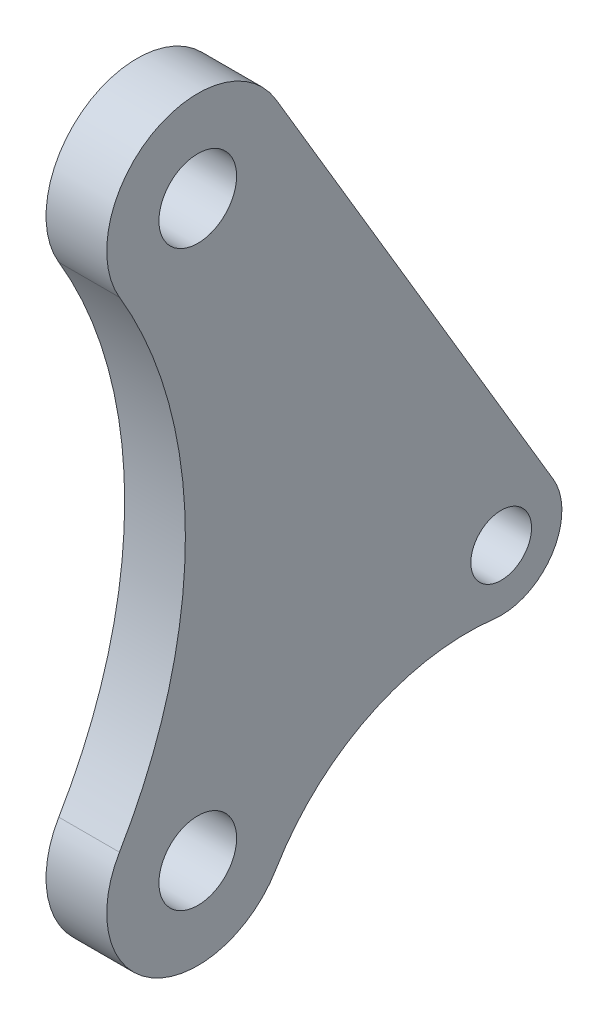
from build123d import *

# Parameters (mm, degrees)
BOSS_EXTRUDE1_DEPTH = 3.175
SKETCH2_R           = 2.032
SKETCH2_R_2         = 1.5875
CUT_EXTRUDE1_DEPTH  = 40.767003046


with BuildPart() as part:
    # Sketch1 → Boss-Extrude1 (new body)
    with BuildSketch(Plane(origin=(0, 0, 0), x_dir=(0, 0, -1), z_dir=(1, 0, 0))):
        with BuildLine():
            Line((4.096045115, 32.429777905), (18.605696743, 7.969851937))
            ThreePointArc((18.605696743, 7.969851937), (18.535994972, 4.618026917), (15.499364997, 3.19729904))
            ThreePointArc((15.499364997, 3.19729904), (8.962719261, 2.075866472), (4.096045115, -2.429777905))
            ThreePointArc((4.096045115, -2.429777905), (-2.429777905, -4.096045115), (-4.096045115, 2.429777905))
            ThreePointArc((-4.096045115, 2.429777905), (-0.648204921, 15), (-4.096045115, 27.570222095))
            ThreePointArc((-4.096045115, 27.570222095), (-2.429777905, 34.096045115), (4.096045115, 32.429777905))
        make_face()
    extrude(amount=BOSS_EXTRUDE1_DEPTH)

    # Sketch2 → Cut-Extrude1 (cut, through all)
    with BuildSketch(Plane(origin=(3.175, 0, 0), x_dir=(0, 0, -1), z_dir=(1, 0, 0))):
        with Locations((0, 30)):
            Circle(SKETCH2_R)
        Circle(SKETCH2_R)
        with Locations((15.875, 6.35)):
            Circle(SKETCH2_R_2)
    extrude(amount=-CUT_EXTRUDE1_DEPTH, mode=Mode.SUBTRACT)


solid = part.part
